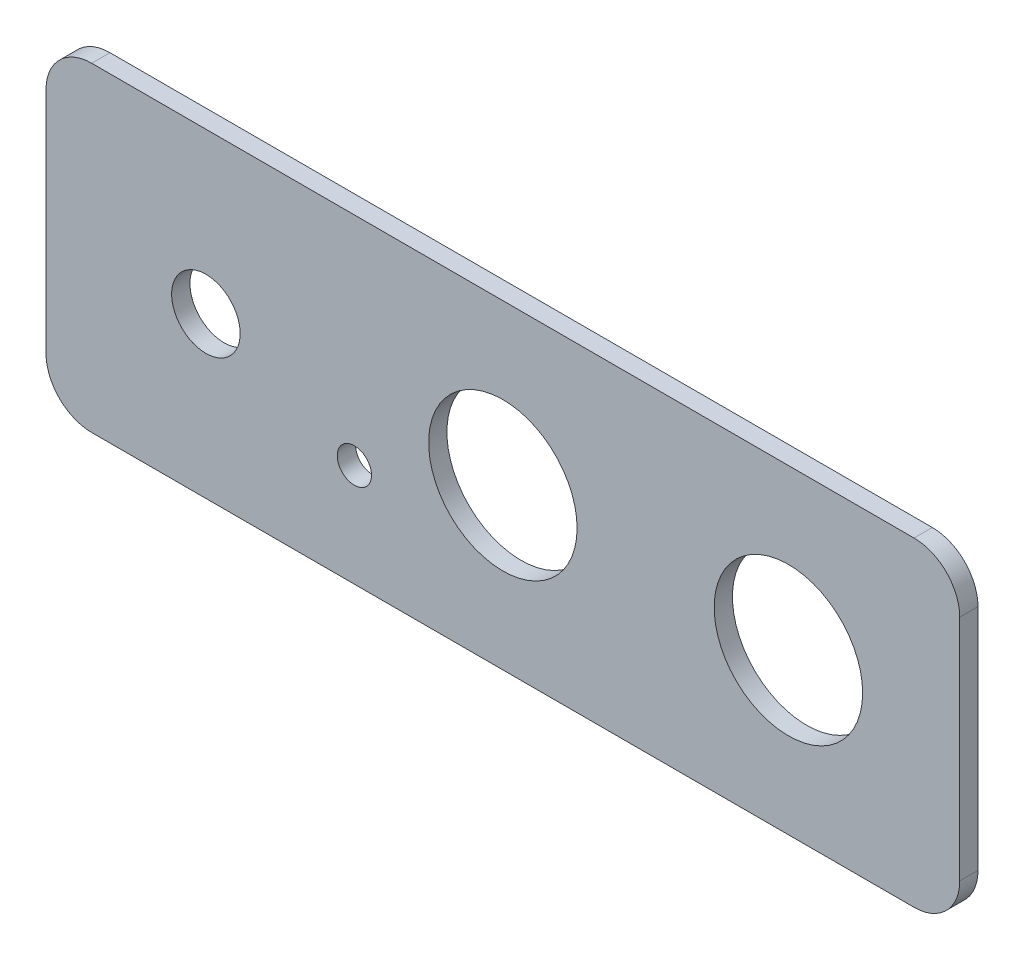
from build123d import *

# Parameters (mm, degrees)
SKETCH1_R           = 3
SKETCH1_R_2         = 6.5
SKETCH1_R_3         = 1.5
BOSS_EXTRUDE1_DEPTH = 1.6


with BuildPart() as part:
    # Sketch1 → Boss-Extrude1 (new body)
    with BuildSketch(Plane.XY):
        with BuildLine():
            Line((-36, 14), (36, 14))
            ThreePointArc((36, 14), (38.828427125, 12.828427125), (40, 10))
            Line((40, 10), (40, -10))
            ThreePointArc((40, -10), (38.828427125, -12.828427125), (36, -14))
            Line((36, -14), (-36, -14))
            ThreePointArc((-36, -14), (-38.828427125, -12.828427125), (-40, -10))
            Line((-40, -10), (-40, 10))
            ThreePointArc((-40, 10), (-38.828427125, 12.828427125), (-36, 14))
        make_face()
        with Locations((-26, 0)):
            Circle(SKETCH1_R, mode=Mode.SUBTRACT)
        Circle(SKETCH1_R_2, mode=Mode.SUBTRACT)
        with Locations((25, 0)):
            Circle(SKETCH1_R_2, mode=Mode.SUBTRACT)
        with Locations((-13, -5)):
            Circle(SKETCH1_R_3, mode=Mode.SUBTRACT)
    extrude(amount=BOSS_EXTRUDE1_DEPTH)


solid = part.part
